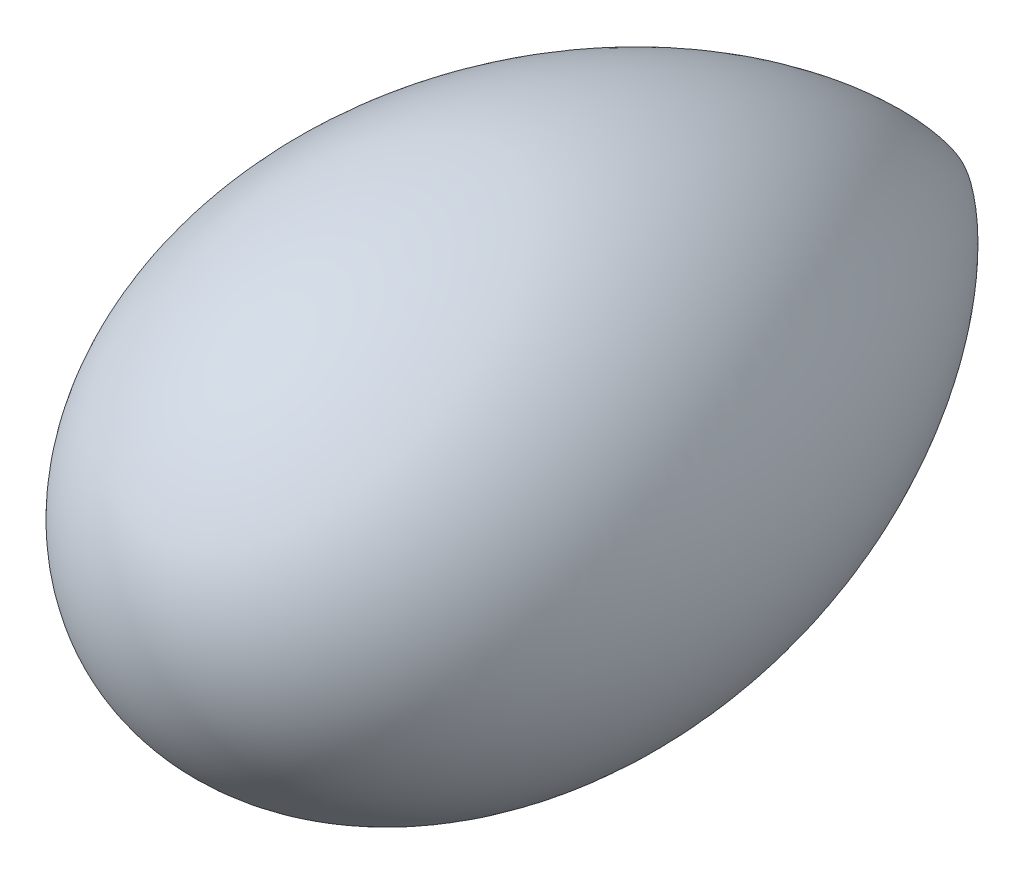
from build123d import *


with BuildPart() as part:
    # Sketch1 → Revolve1 (revolve)
    with BuildSketch(Plane(origin=(0, 0, 0), x_dir=(1, 0, 0), z_dir=(0, 1, 0))):
        with BuildLine():
            Line((0, -55.731300068), (0, 0))
            add(Edge.make_bspline(
                [(0, -55.731300068), (0.059831898, -55.731300068), (0.17956273, -55.730403351), (0.39092862, -55.726368125), (0.65658672, -55.715612466), (0.979392235, -55.695461035), (1.371688702, -55.660577821), (1.760901188, -55.612391123), (2.14871411, -55.551045591), (2.53458865, -55.47928623), (3.174367164, -55.342470485), (4.120946922, -55.07990988), (5.224622881, -54.662341545), (6.397945785, -54.079611454), (7.406412885, -53.470028485), (8.263878462, -52.868555916), (9.080390318, -52.212670057), (9.854582902, -51.507423809), (10.76839924, -50.570185269), (11.777934798, -49.365452794), (12.739418619, -47.989439071), (13.631142909, -46.444788513), (14.410188565, -44.841128778), (15.079747926, -43.188397385), (15.840993952, -40.845798591), (16.517859331, -37.773506207), (16.908634054, -34.121702679), (16.856556989, -29.926544819), (16.345988652, -25.763445436), (15.409598638, -21.675793824), (14.07342411, -17.701228914), (12.357435247, -13.875415386), (10.275800584, -10.235249962), (8.140932852, -7.250376992), (6.086269543, -4.870523365), (4.355751101, -3.171224704), (3.065904541, -2.050803142), (1.974466229, -1.215082492), (1.193712961, -0.680668396), (0.587508961, -0.310465881), (0.255429092, -0.125951122), (0.08578369, -0.04072326), (0, 0)],
                knots=[0.085324672, 0.085324672, 0.085324672, 0.085324672, 0.085324672, 0.088748551, 0.09217243, 0.09559631, 0.099020189, 0.105867948, 0.112715706, 0.11613959, 0.119563473, 0.12641124, 0.146954545, 0.167497862, 0.181193346, 0.194888829, 0.208584416, 0.222280002, 0.235975531, 0.24967106, 0.277062181, 0.30445317, 0.323693004, 0.342932838, 0.370323926, 0.397715015, 0.452497194, 0.507279374, 0.562061568, 0.616843749, 0.67162593, 0.726408051, 0.781190345, 0.83597255, 0.890754668, 0.918145814, 0.94553696, 0.96283045, 0.98012394, 0.99006197, 0.995030985, 1, 1, 1, 1, 1], degree=4))
        make_face()
    revolve(axis=Axis((0, 0, 0), (0, 0, 1)))


solid = part.part
